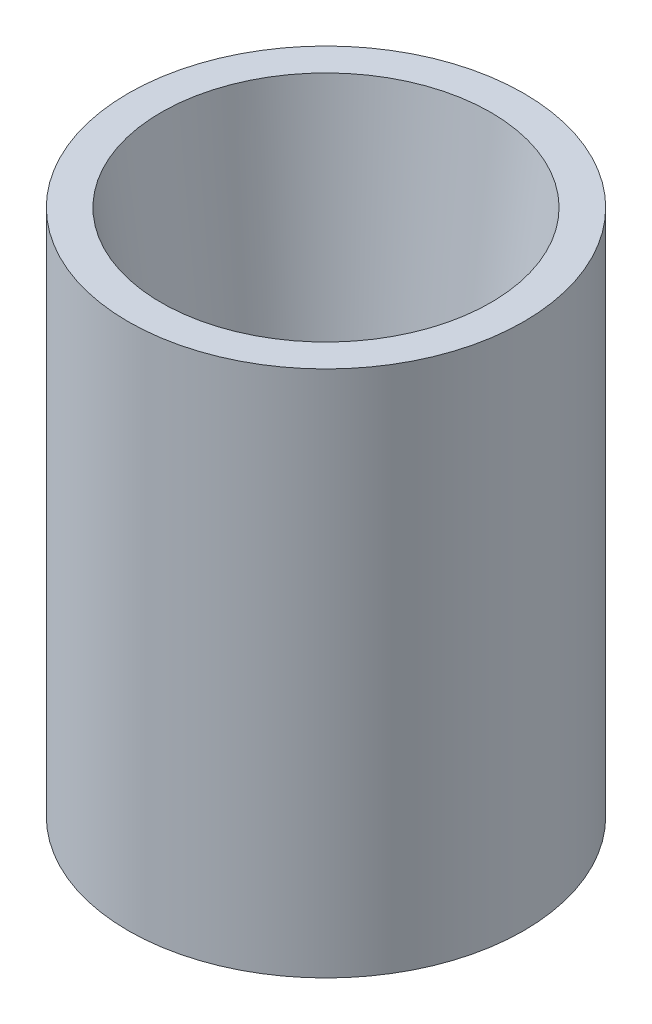
from build123d import *

# Parameters (mm, degrees)
SKETCH1_W = 30
SKETCH1_H = 80


with BuildPart() as part:
    # Sketch1 → Revolve1 (revolve)
    with BuildSketch(Plane.XY, mode=Mode.PRIVATE) as revolve1_sk:
        with Locations((15, 40)):
            Rectangle(SKETCH1_W, SKETCH1_H)
    revolve(revolve1_sk.sketch.rotate(Axis((0, 0, 0), (0, 1, 0)), 90), axis=Axis((0, 0, 0), (0, 1, 0)))

    # Sketch3 → Cut-Revolve1 (revolve, cut)
    with BuildSketch(Plane.XY, mode=Mode.PRIVATE) as cut_revolve1_sk:
        Polygon((0, 10), (16.405080737, 10), (25, 80), (0, 80), align=None)
    revolve(cut_revolve1_sk.sketch.rotate(Axis((0, 0, 0), (0, 1, 0)), 90), axis=Axis((0, 0, 0), (0, 1, 0)), mode=Mode.SUBTRACT)


solid = part.part
